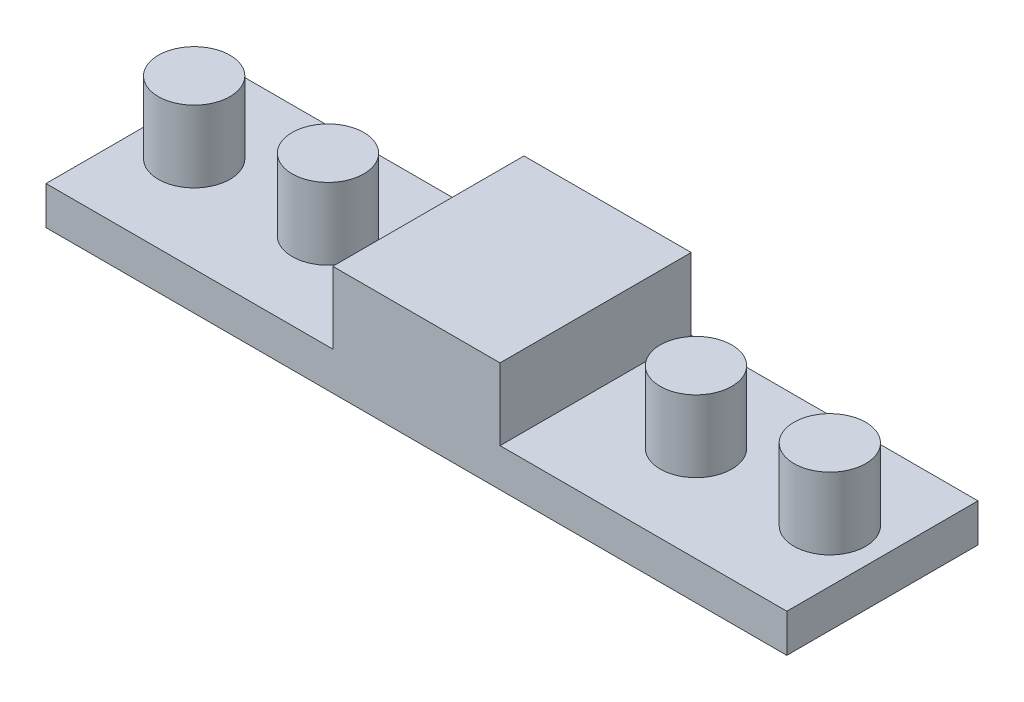
from build123d import *

# Parameters (mm, degrees)
SKETCH_1_W      = 3.5
SKETCH_1_H      = 4
SKETCH_1_W_2    = 6
EXTRUDE_1_DEPTH = 0.8
EXTRUDE_START   = 0.8
SKETCH_1_3_W    = 3.5
SKETCH_1_3_H    = 4
EXTRUDE_2_DEPTH = 1.5
SKETCH_2_R      = 0.75
EXTRUDE_3_DEPTH = 1.5


with BuildPart() as part:
    # Эскиз1 → Бобышка-Вытянуть1 (new body)
    with BuildSketch(Plane(origin=(0, 0, 0), x_dir=(1, 0, 0), z_dir=(0, 1, 0))):
        Rectangle(SKETCH_1_W, SKETCH_1_H)
        with Locations((-4.75, 0)):
            Rectangle(SKETCH_1_W_2, SKETCH_1_H)
        with Locations((4.75, 0)):
            Rectangle(SKETCH_1_W_2, SKETCH_1_H)
    extrude(amount=EXTRUDE_1_DEPTH)

    # Эскиз1<3> → Бобышка-Вытянуть2 (add)
    with BuildSketch(Plane(origin=(0, 0, 0), x_dir=(1, 0, 0), z_dir=(0, 1, 0)).offset(EXTRUDE_START)):
        Rectangle(SKETCH_1_3_W, SKETCH_1_3_H)
    extrude(amount=EXTRUDE_2_DEPTH)

    # Эскиз2 → Бобышка-Вытянуть3 (add)
    with BuildSketch(Plane(origin=(0, 0.8, 0), x_dir=(1, 0, 0), z_dir=(0, 1, 0))):
        with Locations(Location((-3.85, 0, 0), (0, 0, 270))):
            Circle(SKETCH_2_R)
        with Locations(Location((-6.65, 0, 0), (0, 0, 270))):
            Circle(SKETCH_2_R)
        with Locations(Location((6.65, 0, 0), (0, 0, 90))):
            Circle(SKETCH_2_R)
        with Locations(Location((3.85, 0, 0), (0, 0, 90))):
            Circle(SKETCH_2_R)
    extrude(amount=EXTRUDE_3_DEPTH)


solid = part.part
